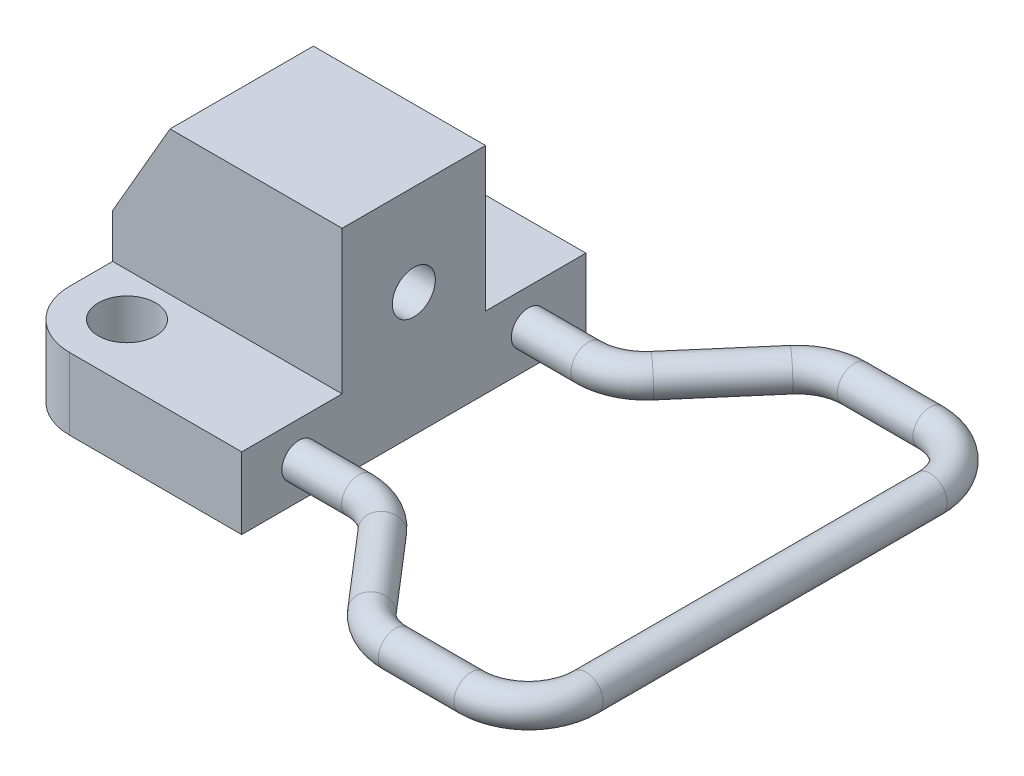
from build123d import *

# Parameters (mm, degrees)
EXTRUDE_3_DEPTH     = 40
FILLET_1_R          = 20
SKETCH_17_R         = 10
CUT_EXTRUDE_2_DEPTH = 88.749643874
CHAMFER_1_SIZE      = 20
CHAMFER_1_SIZE2     = 34.641016151
SWEEP_2_PROFILE_R   = 7.5
SWEEP_2_2_PROFILE_R = 6


with BuildPart() as part:
    # 草图15 → 凸台-拉伸3 (new, symmetric)
    with BuildSketch(Plane(origin=(0, 0, 0), x_dir=(0, 0, -1), z_dir=(1, 0, 0))):
        Polygon((-60, 0), (-25, 0), (-25, 50), (25, 50), (25, 0), (60, 0), (60, -25), (-60, -25), align=None)
    extrude(amount=EXTRUDE_3_DEPTH, both=True)

    # 圆角1
    fillet_1_edges = [part.edges().sort_by_distance(p)[0] for p in [
        (-40, -12.5, -60),
        (-40, -12.5, 60),
    ]]
    fillet(fillet_1_edges, radius=FILLET_1_R)

    # 草图17 → 切除-拉伸2 (cut, through all)
    with BuildSketch(Plane(origin=(0, 0, 0), x_dir=(1, 0, 0), z_dir=(0, 1, 0))):
        with Locations(Location((-20, 40, 0), (0, 0, 270))):
            Circle(SKETCH_17_R)
    cut_extrude_2 = extrude(amount=-CUT_EXTRUDE_2_DEPTH, mode=Mode.SUBTRACT)

    # 镜向1: 切除-拉伸2 across plane
    add(cut_extrude_2.mirror(Plane.XY), mode=Mode.SUBTRACT)

    # 倒角1
    chamfer_1_edges = [part.edges().sort_by_distance(p)[0] for p in [
        (-40, 50, 0),
    ]]
    chamfer_1_side = [part.faces().sort_by_distance(p)[0] for p in [
        (0, 50, 0),
    ]]
    chamfer(chamfer_1_edges, length=CHAMFER_1_SIZE, length2=CHAMFER_1_SIZE2, reference=chamfer_1_side[0])

    # Sweep 2: sweep along a path in 草图19
    with BuildLine(Plane.XY) as sweep_2_path:
        Line((-30, 32.679491924), (-11.908563538, 22.234396213))
        ThreePointArc((-11.908563538, 22.234396213), (-4.673134891, 19.237383538), (3.091436462, 18.215158327))
        Line((3.091436462, 18.215158327), (40, 18.215158327))
    # Sweep 2 profile (on start of the path) → Sweep 2 (sweep, cut)
    with BuildSketch(Plane(origin=(-30, 32.679491924, 0), x_dir=(0.500000000000001, 0.866025403784438, 0), z_dir=(0.866025403784438, -0.500000000000001, 0))):
        Circle(SWEEP_2_PROFILE_R)
    sweep(path=sweep_2_path.line, mode=Mode.SUBTRACT)

    # Sweep 2 2: sweep along a path in 草图26
    with BuildLine(Plane(origin=(0, -12.5, 0), x_dir=(1, 0, 0), z_dir=(0, 1, 0))) as sweep_2_2_path:
        Line((40, 40), (60.827915323, 40))
        ThreePointArc((60.827915323, 40), (69.165079187, 41.820569352), (75.984404551, 46.95083013))
        Line((75.984404551, 46.95083013), (98.454098123, 73.04916987))
        ThreePointArc((98.454098123, 73.04916987), (105.273423486, 78.179430648), (113.610587351, 80))
        Line((113.610587351, 80), (140, 80))
        ThreePointArc((140, 80), (154.142135624, 74.142135624), (160, 60))
        Line((160, 60), (160, -60))
        ThreePointArc((160, -60), (154.142135624, -74.142135624), (140, -80))
        Line((140, -80), (113.610587351, -80))
        ThreePointArc((113.610587351, -80), (105.273423486, -78.179430648), (98.454098123, -73.04916987))
        Line((98.454098123, -73.04916987), (75.984404551, -46.95083013))
        ThreePointArc((75.984404551, -46.95083013), (69.165079187, -41.820569352), (60.827915323, -40))
        Line((60.827915323, -40), (40, -40))
    # Sweep 2 2 profile (on start of the path) → Sweep 2 2 (sweep)
    with BuildSketch(Plane(origin=(40, -12.5, -40), x_dir=(0, 0, 1), z_dir=(1, 0, 0))):
        Circle(SWEEP_2_2_PROFILE_R)
    sweep(path=sweep_2_2_path.line)


solid = part.part
